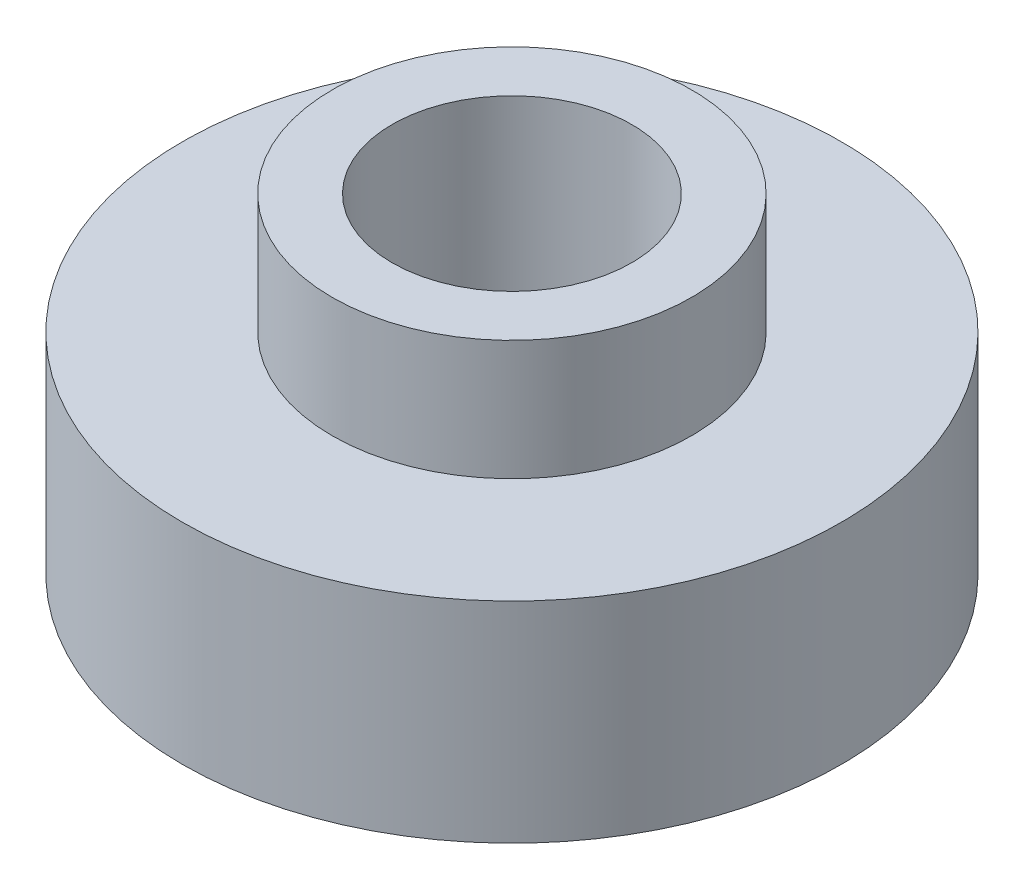
from build123d import *

# Parameters (mm, degrees)
SKETCH1_R           = 11
BOSS_EXTRUDE1_DEPTH = 7
SKETCH2_R           = 6
BOSS_EXTRUDE2_DEPTH = 4
CUT_EXTRUDE1_REACH  = 21.053
SKETCH3_R           = 4


with BuildPart() as part:
    # Sketch1 → Boss-Extrude1 (new body)
    with BuildSketch(Plane(origin=(0, 0, 0), x_dir=(1, 0, 0), z_dir=(0, 1, 0))):
        with Locations(Location((0, 0, 0), (0, 0, 270))):
            Circle(SKETCH1_R)
    extrude(amount=BOSS_EXTRUDE1_DEPTH)

    # Sketch2 → Boss-Extrude2 (add)
    with BuildSketch(Plane(origin=(0, 7, 0), x_dir=(1, 0, 0), z_dir=(0, 1, 0))):
        with Locations(Location((0, 0, 0), (0, 0, 270))):
            Circle(SKETCH2_R)
    extrude(amount=BOSS_EXTRUDE2_DEPTH)

    # Sketch3 → Cut-Extrude1 (cut, up to next)
    with BuildSketch(Plane(origin=(0, 11, 0), x_dir=(1, 0, 0), z_dir=(0, 1, 0)), mode=Mode.PRIVATE) as cut_extrude1_sk1:
        with Locations(Location((0, 0, 0), (0, 0, 270))):
            Circle(SKETCH3_R)
    cut_extrude1_tool1 = extrude(cut_extrude1_sk1.sketch, amount=-CUT_EXTRUDE1_REACH, mode=Mode.PRIVATE) & part.part
    add(cut_extrude1_tool1.solids().sort_by_distance((0, 11, 0))[0], mode=Mode.SUBTRACT)


solid = part.part
